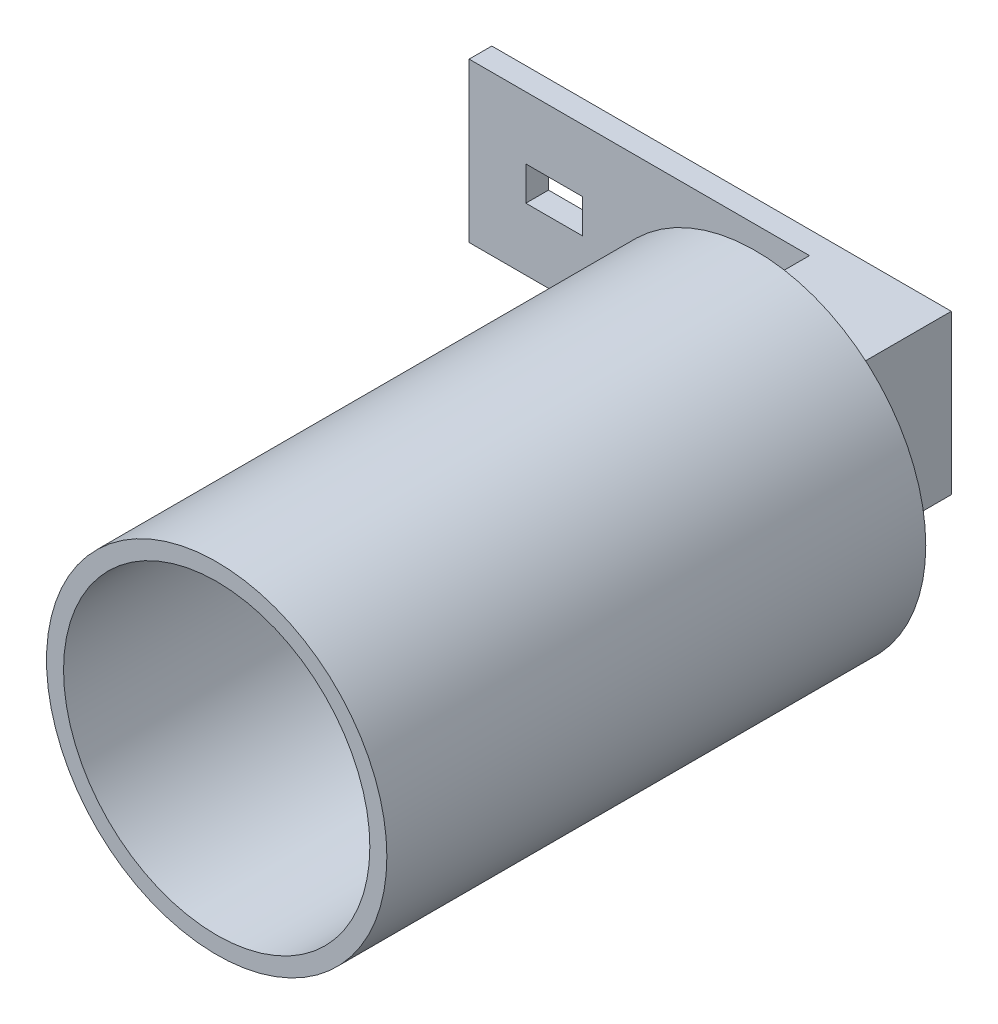
from build123d import *

# Parameters (mm, degrees)
ESQUISSE1_R             = 30
BOSS_EXTRU_1_DEPTH      = 95
ESQUISSE2_R             = 27
ENL_V_MAT_EXTRU_1_DEPTH = 80
ESQUISSE3_W             = 21
ESQUISSE3_H             = 28
BOSS_EXTRU_2_DEPTH      = 24
ESQUISSE4_W             = 4
ESQUISSE4_H             = 28
BOSS_EXTRU_3_DEPTH      = 60
ENL_V_MAT_EXTRU_2_REACH = 143.532
ESQUISSE5_W             = 10
ESQUISSE5_H             = 6


with BuildPart() as part:
    # Esquisse1 → Boss.-Extru.1 (new body)
    with BuildSketch(Plane.XY):
        Circle(ESQUISSE1_R)
    extrude(amount=BOSS_EXTRU_1_DEPTH)

    # Esquisse2 → Enlèv. mat.-Extru.1 (cut)
    with BuildSketch(Plane.XY.offset(95)):
        Circle(ESQUISSE2_R)
    extrude(amount=-ENL_V_MAT_EXTRU_1_DEPTH, mode=Mode.SUBTRACT)

    # Esquisse3 → Boss.-Extru.2 (add)
    with BuildSketch(Plane(origin=(0, 0, 0), x_dir=(-1, 0, 0), z_dir=(0, 0, -1))):
        Rectangle(ESQUISSE3_W, ESQUISSE3_H)
    extrude(amount=BOSS_EXTRU_2_DEPTH)

    # Esquisse4 → Boss.-Extru.3 (add)
    with BuildSketch(Plane.ZY.offset(10.5)):
        with Locations((-22, 0)):
            Rectangle(ESQUISSE4_W, ESQUISSE4_H)
    extrude(amount=BOSS_EXTRU_3_DEPTH)

    # Esquisse5 → Enlèv. mat.-Extru.2 (cut, up to next)
    with BuildSketch(Plane(origin=(0, 0, -24), x_dir=(-1, 0, 0), z_dir=(0, 0, -1)), mode=Mode.PRIVATE) as enl_v_mat_extru_2_sk1:
        with Locations((55.5, 0)):
            Rectangle(ESQUISSE5_W, ESQUISSE5_H)
    enl_v_mat_extru_2_tool1 = extrude(enl_v_mat_extru_2_sk1.sketch, amount=-ENL_V_MAT_EXTRU_2_REACH, mode=Mode.PRIVATE) & part.part
    add(enl_v_mat_extru_2_tool1.solids().sort_by_distance((-55.5, 0, -24))[0], mode=Mode.SUBTRACT)


solid = part.part
